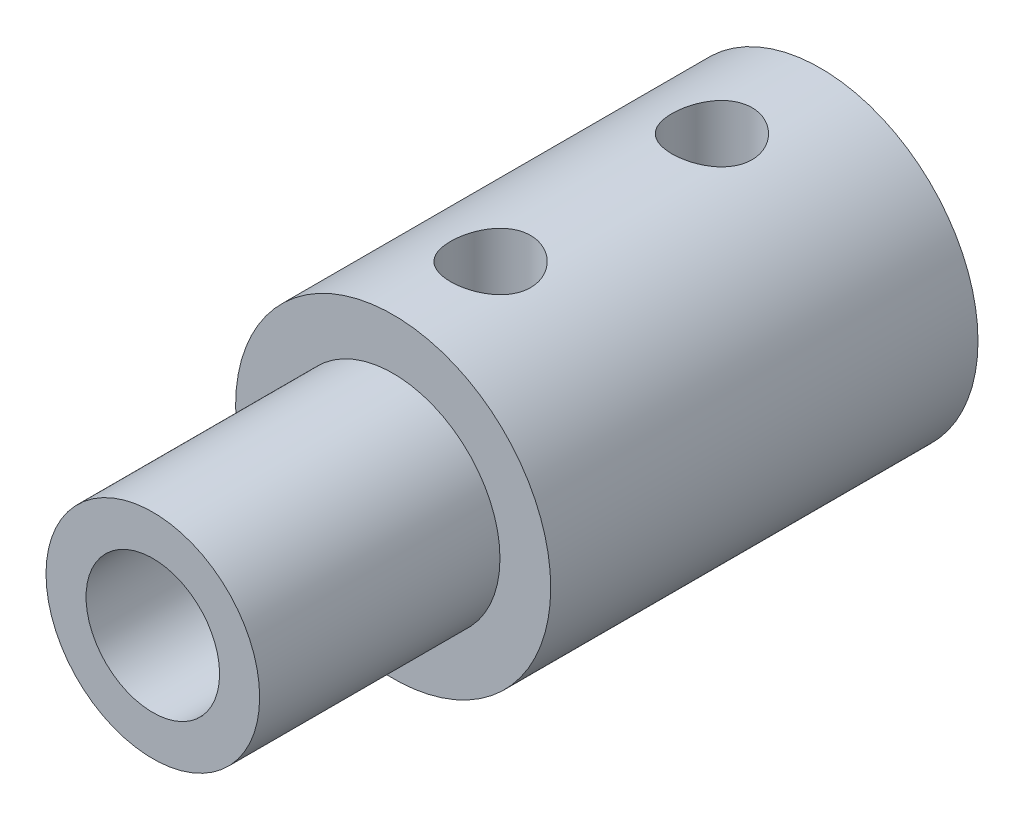
from build123d import *

# Parameters (mm, degrees)
SKETCH_1_R          = 5.9
EXTRUDE_1_DEPTH     = 25
SKETCH_2_R          = 2.5
CUT_EXTRUDE_2_DEPTH = 10
SKETCH_3_R          = 1.5
CUT_EXTRUDE_3_DEPTH = 15
SKETCH_5_R          = 1.5
CUT_EXTRUDE_4_DEPTH = 6
CUT_EXTRUDE_START   = -9
SKETCH_6_R          = 5.9
SKETCH_6_R_2        = 4
CUT_EXTRUDE_5_DEPTH = 9


with BuildPart() as part:
    # Эскиз1 → Вытянуть1 (new body)
    with BuildSketch(Plane.XY):
        Circle(SKETCH_1_R)
    extrude(amount=EXTRUDE_1_DEPTH)

    # Эскиз2 → Вытянуть2 (cut)
    with BuildSketch(Plane.XY.offset(25)):
        Circle(SKETCH_2_R)
    extrude(amount=-CUT_EXTRUDE_2_DEPTH, mode=Mode.SUBTRACT)

    # Эскиз3 → Вытянуть3 (cut)
    with BuildSketch(Plane(origin=(0, 0, 0), x_dir=(-1, 0, 0), z_dir=(0, 0, -1))):
        Circle(SKETCH_3_R)
    extrude(amount=-CUT_EXTRUDE_3_DEPTH, mode=Mode.SUBTRACT)

    # Эскиз5 → Вытянуть4 (cut)
    with BuildSketch(Plane(origin=(0, 7, 0), x_dir=(-1, 0, 0), z_dir=(0, 1, 0))):
        with Locations(Location((0, 4.063182322, 0), (0, 0, 90))):
            Circle(SKETCH_5_R)
        with Locations(Location((0, 12.352632006, 0), (0, 0, 90))):
            Circle(SKETCH_5_R)
    extrude(amount=-CUT_EXTRUDE_4_DEPTH, mode=Mode.SUBTRACT)

    # Эскиз6 → Вытянуть5 (cut)
    with BuildSketch(Plane.XY.offset(25).offset(CUT_EXTRUDE_START)):
        Circle(SKETCH_6_R)
        Circle(SKETCH_6_R_2, mode=Mode.SUBTRACT)
    extrude(amount=CUT_EXTRUDE_5_DEPTH, mode=Mode.SUBTRACT)


solid = part.part
